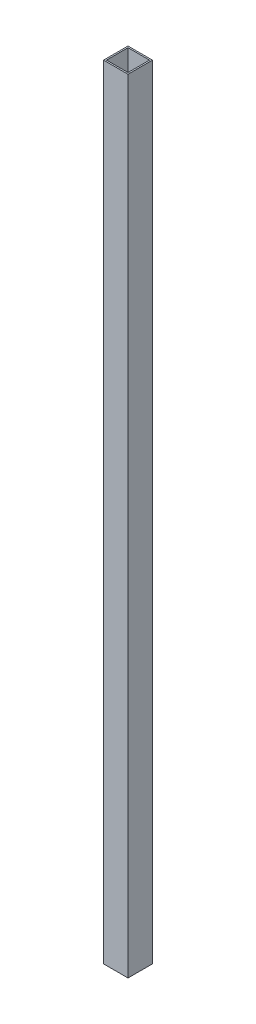
from build123d import *

# Parameters (mm, degrees)
SKETCH1_W           = 12.5
SKETCH1_H           = 12.5
SKETCH1_W_2         = 11
SKETCH1_H_2         = 11
BOSS_EXTRUDE3_DEPTH = 400


with BuildPart() as part:
    # Sketch1 → Boss-Extrude3 (new body)
    with BuildSketch(Plane(origin=(0, 0, 0), x_dir=(1, 0, 0), z_dir=(0, 1, 0))):
        with Locations((-20.377754415, -4.412827368)):
            Rectangle(SKETCH1_W, SKETCH1_H)
        with Locations((-20.377754415, -4.412827368)):
            Rectangle(SKETCH1_W_2, SKETCH1_H_2, mode=Mode.SUBTRACT)
    extrude(amount=BOSS_EXTRUDE3_DEPTH)


solid = part.part
